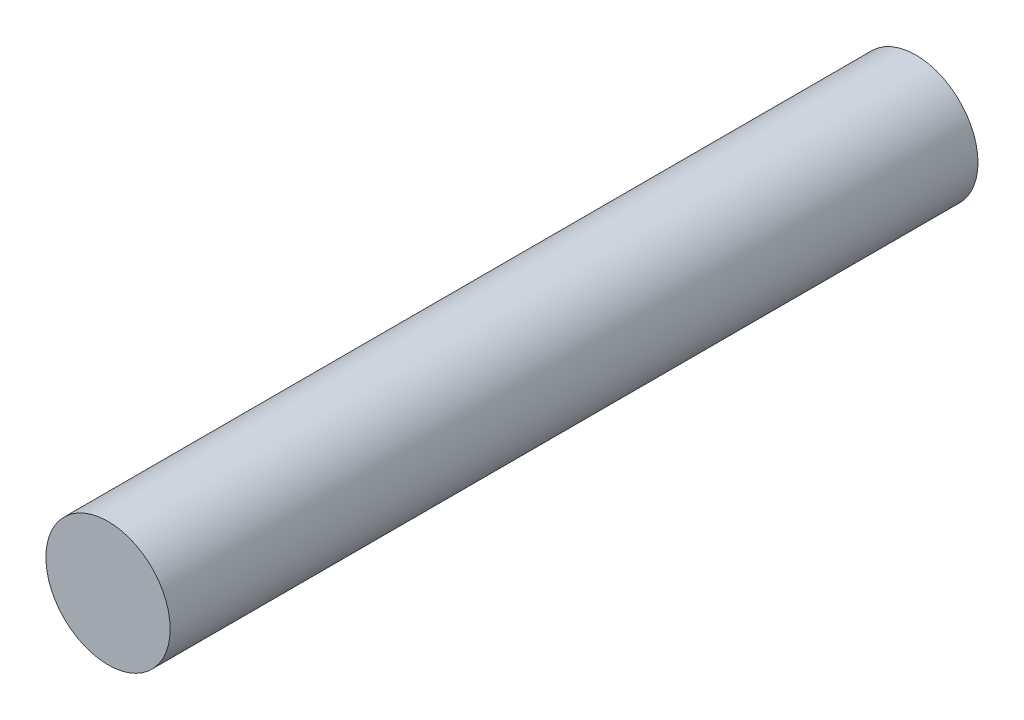
from build123d import *

# Parameters (mm, degrees)
SKETCH1_R           = 3
BOSS_EXTRUDE1_DEPTH = 39


with BuildPart() as part:
    # Sketch1 → Boss-Extrude1 (new body)
    with BuildSketch(Plane.XY):
        Circle(SKETCH1_R)
    extrude(amount=BOSS_EXTRUDE1_DEPTH)


solid = part.part
